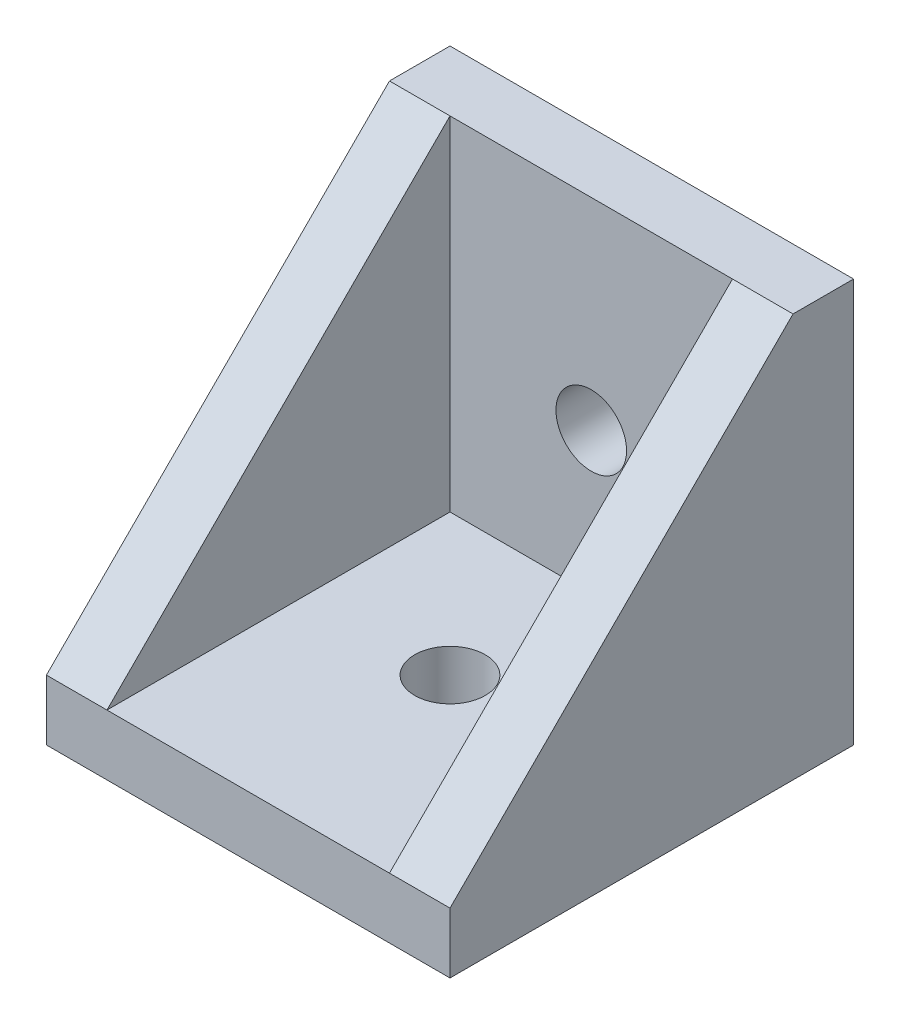
from build123d import *

# Parameters (mm, degrees)
SKETCH_1_W          = 20
SKETCH_1_H          = 20
SKETCH_1_R          = 1.75
EXTRUDE_1_DEPTH     = 3
SKETCH_2_W          = 20
SKETCH_2_H          = 3
EXTRUDE_2_DEPTH     = 17
SKETCH_3_R          = 1.75
CUT_EXTRUDE_1_DEPTH = 17
EXTRUDE_4_DEPTH     = 3
EXTRUDE_5_DEPTH     = 3


with BuildPart() as part:
    # Эскиз1 → Бобышка-Вытянуть1 (new body)
    with BuildSketch(Plane(origin=(0, 0, 0), x_dir=(1, 0, 0), z_dir=(0, 1, 0))):
        Rectangle(SKETCH_1_W, SKETCH_1_H)
        with Locations(Location((0, 0, 0), (0, 0, 270))):
            Circle(SKETCH_1_R, mode=Mode.SUBTRACT)
    extrude(amount=EXTRUDE_1_DEPTH)

    # Эскиз2 → Бобышка-Вытянуть2 (add)
    with BuildSketch(Plane(origin=(0, 3, 0), x_dir=(1, 0, 0), z_dir=(0, 1, 0))):
        with Locations((0, 8.5)):
            Rectangle(SKETCH_2_W, SKETCH_2_H)
    extrude(amount=EXTRUDE_2_DEPTH)

    # Эскиз3 → Вырез-Вытянуть1 (cut)
    with BuildSketch(Plane.XY.offset(-7)):
        with Locations((0, 10)):
            Circle(SKETCH_3_R)
    extrude(amount=-CUT_EXTRUDE_1_DEPTH, mode=Mode.SUBTRACT)

    # Эскиз4 → Бобышка-Вытянуть4 (add)
    with BuildSketch(Plane.ZY.offset(10)):
        Polygon((-7, 20), (10, 3), (-7, 3), align=None)
    extrude(amount=-EXTRUDE_4_DEPTH)

    # Эскиз5 → Бобышка-Вытянуть5 (add)
    with BuildSketch(Plane(origin=(10, 0, 0), x_dir=(0, 0, -1), z_dir=(1, 0, 0))):
        Polygon((7, 20), (7, 3), (-10, 3), align=None)
    extrude(amount=-EXTRUDE_5_DEPTH)


solid = part.part
